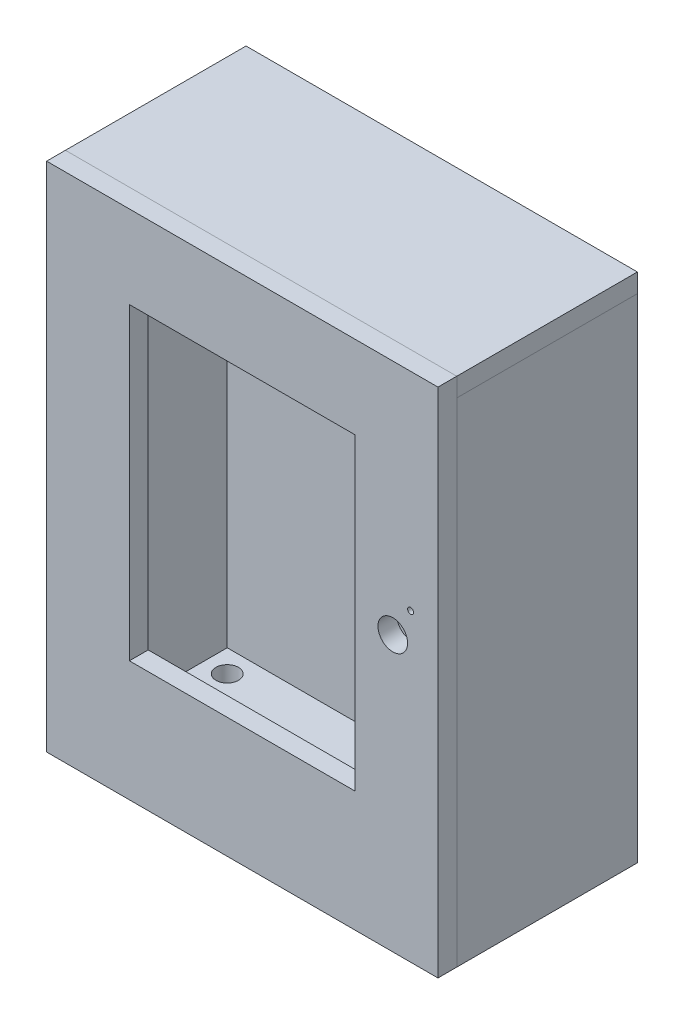
from build123d import *

# Parameters (mm, degrees)
SKETCH1_W             = 330.2
SKETCH1_H             = 431.8
SKETCH1_R             = 12.5
SKETCH1_R_2           = 2.5
SKETCH1_W_2           = 190.5
SKETCH1_H_2           = 260.35
BOSS_EXTRUDE1_DEPTH   = 7.9375
SKETCH3_W             = 152.4
SKETCH3_H             = 415.925
BOSS_EXTRUDE2_DEPTH   = 15.875
BOSS_EXTRUDE6_START   = -15.875
SKETCH8_W             = 298.45
SKETCH8_H             = 415.925
BOSS_EXTRUDE6_DEPTH   = 15.875
SKETCH11_W            = 298.45
SKETCH11_H            = 120.65
SKETCH11_R            = 9.525
BOSS_EXTRUDE7_DEPTH   = 15.875
SKETCH14_W            = 330.2
SKETCH14_H            = 152.4
BOSS_EXTRUDE8_DEPTH   = 15.875
BOSS_EXTRUDE5_DEPTH   = 139.7
BOSS_EXTRUDE5_2_DEPTH = 139.7


with BuildPart() as part:
    # Sketch1 → Boss-Extrude1 (new, symmetric)
    with BuildSketch(Plane.XY):
        with Locations((0, -15.875)):
            Rectangle(SKETCH1_W, SKETCH1_H)
        with Locations((127, 0)):
            Circle(SKETCH1_R, mode=Mode.SUBTRACT)
        with Locations((142, 25)):
            Circle(SKETCH1_R_2, mode=Mode.SUBTRACT)
        Rectangle(SKETCH1_W_2, SKETCH1_H_2, mode=Mode.SUBTRACT)
    extrude(amount=BOSS_EXTRUDE1_DEPTH, both=True)


with BuildPart() as body_2:
    # Sketch3 → Boss-Extrude2 (new body)
    with BuildSketch(Plane(origin=(165.1, 0, 0), x_dir=(0, 0, -1), z_dir=(1, 0, 0))):
        with Locations((84.1375, -23.8125)):
            Rectangle(SKETCH3_W, SKETCH3_H)
    extrude(amount=-BOSS_EXTRUDE2_DEPTH)


with BuildPart() as body_3:
    # Mirror1: mirrored copy
    add(body_2.part.mirror(Plane(origin=(0, 0, 0), x_dir=(0, 0, 1), z_dir=(1, 0, 0))))


with BuildPart() as body_4:
    # Sketch8 → Boss-Extrude6 (new body)
    with BuildSketch(Plane(origin=(0, 0, -160.3375), x_dir=(-1, 0, 0), z_dir=(0, 0, -1)).offset(BOSS_EXTRUDE6_START)):
        with Locations((0, -23.8125)):
            Rectangle(SKETCH8_W, SKETCH8_H)
    extrude(amount=-BOSS_EXTRUDE6_DEPTH)


with BuildPart() as body_5:
    # Sketch11 → Boss-Extrude7 (new body)
    with BuildSketch(Plane.XZ.offset(231.775)):
        with Locations((0, -68.2625)):
            Rectangle(SKETCH11_W, SKETCH11_H)
        with Locations(Location((-130.175, -109.5375, 0), (0, 0, 270))):
            Circle(SKETCH11_R, mode=Mode.SUBTRACT)
    extrude(amount=-BOSS_EXTRUDE7_DEPTH)


with BuildPart() as body_6:
    # Sketch14 → Boss-Extrude8 (new body)
    with BuildSketch(Plane(origin=(0, 200.025, 0), x_dir=(1, 0, 0), z_dir=(0, 1, 0))):
        with Locations((0, 84.1375)):
            Rectangle(SKETCH14_W, SKETCH14_H)
    extrude(amount=-BOSS_EXTRUDE8_DEPTH)


with BuildPart() as body_7:
    # Sketch7 → Boss-Extrude5 (new, symmetric)
    with BuildSketch(Plane(origin=(0, 0, 0), x_dir=(0, 0, -1), z_dir=(1, 0, 0))):
        Polygon((144.4625, 95.25), (144.4625, 34.925), (160.3375, 19.05), (160.3375, 95.25), align=None)
    extrude(amount=BOSS_EXTRUDE5_DEPTH, both=True)


with BuildPart() as body_8:
    # Sketch7 → Boss-Extrude5 2 (new, symmetric)
    with BuildSketch(Plane(origin=(0, 0, 0), x_dir=(0, 0, -1), z_dir=(1, 0, 0))):
        Polygon((160.3375, -82.55), (144.4625, -82.55), (144.4625, -142.875), (160.3375, -158.75), align=None)
    extrude(amount=BOSS_EXTRUDE5_2_DEPTH, both=True)


solid = Compound([part.part, body_2.part, body_3.part, body_4.part, body_5.part, body_6.part, body_7.part, body_8.part])
